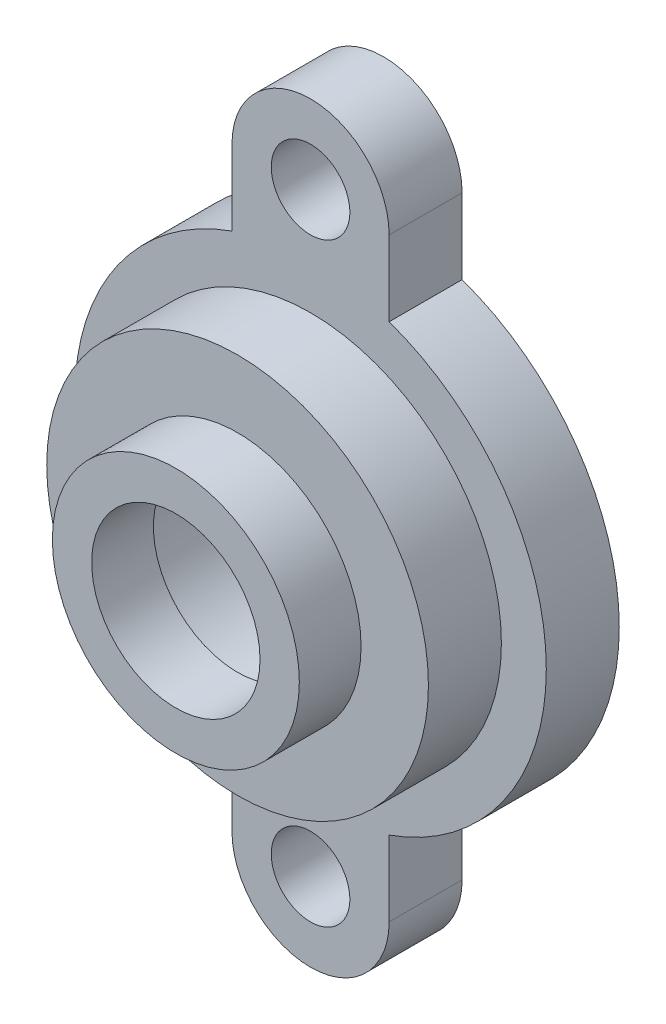
from build123d import *

# Parameters (mm, degrees)
SKETCH_1_R          = 21
EXTRUDE_2_DEPTH     = 6.5
EXTRUDE_4_DEPTH     = 6.5
SKETCH_3_R          = 9.5
SKETCH_3_R_2        = 3.5
CUT_EXTRUDE_1_DEPTH = 41.068691019


with BuildPart() as part:
    # 草图1 → 凸台-拉伸2 (new body)
    with BuildSketch(Plane.XY):
        with Locations(Location((0, 0, 0), (0, 0, 180))):
            Circle(SKETCH_1_R)
    extrude(amount=EXTRUDE_2_DEPTH)

    # 草图2 → 凸台-拉伸4 (add)
    with BuildSketch(Plane.XY):
        with BuildLine():
            Line((-7, -26.5), (-7, 26.5))
            ThreePointArc((-7, 26.5), (0, 33.5), (7, 26.5))
            Line((7, 26.5), (7, -26.5))
            ThreePointArc((7, -26.5), (0, -33.5), (-7, -26.5))
        make_face()
    extrude(amount=EXTRUDE_4_DEPTH)

    # 草图3 → 切除-拉伸1 (cut, through all)
    with BuildSketch(Plane.XY):
        with Locations(Location((0, 0, 0), (0, 0, 180))):
            Circle(SKETCH_3_R)
        with Locations(Location((0, -26.5, 0), (0, 0, 180))):
            Circle(SKETCH_3_R_2)
        with Locations(Location((0, 26.5, 0), (0, 0, 180))):
            Circle(SKETCH_3_R_2)
    extrude(amount=CUT_EXTRUDE_1_DEPTH, mode=Mode.SUBTRACT)

    # 草图4 → 旋转1 (revolve)
    with BuildSketch(Plane(origin=(0, 0, 0), x_dir=(0, 0, -1), z_dir=(1, 0, 0)), mode=Mode.PRIVATE) as revolve_1_sk:
        Polygon((0, 9.5), (0, 17), (-13, 17), (-13, 11), (-18.5, 11), (-18.5, 7.5), (-13, 7.5), (-13, 9.5), align=None)
    revolve(revolve_1_sk.sketch.rotate(Axis((0, 0, 23.5), (0, 0, -1)), 90), axis=Axis((0, 0, 23.5), (0, 0, -1)))


solid = part.part
